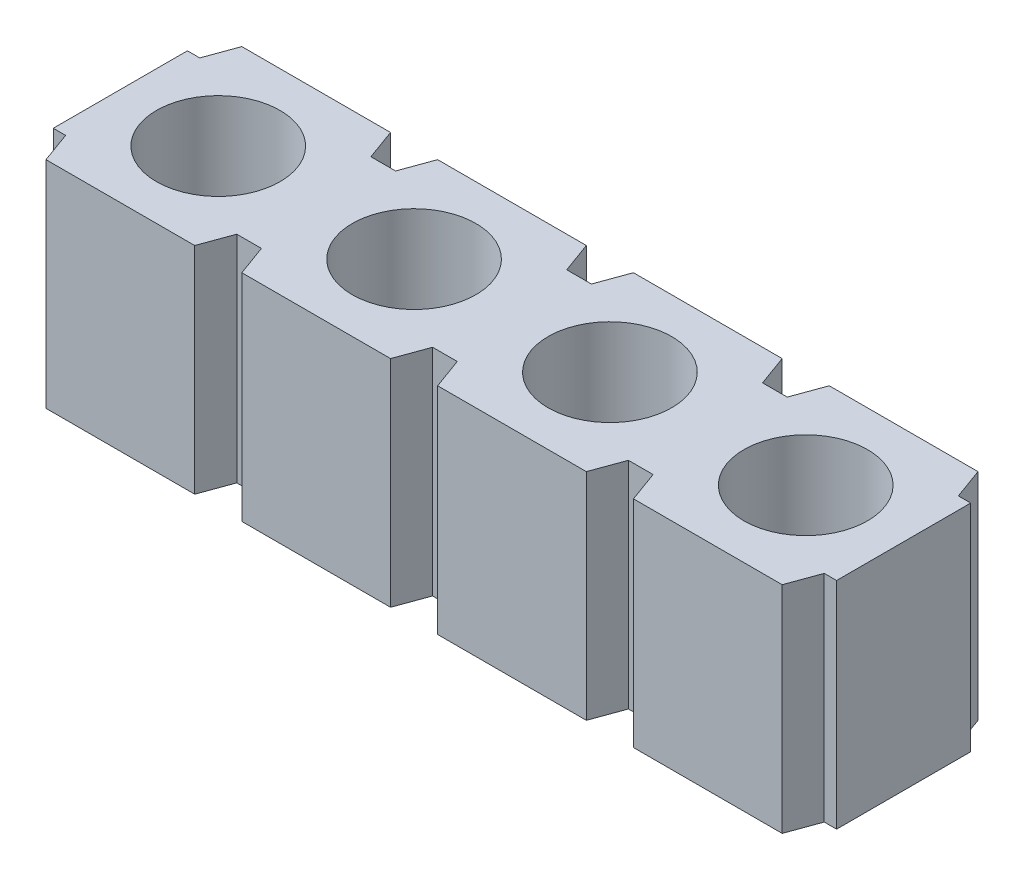
from build123d import *

# Parameters (mm, degrees)
EXTRUDE1_DEPTH  = 2.794
HOLE1_D         = 1.60274
EXTRUDE2_DEPTH  = 2.794
LPATTERN1_COUNT = 5
LPATTERN1_PITCH = 2.54
LPATTERN2_COUNT = 63
LPATTERN2_PITCH = 2.54


with BuildPart() as part:
    # Sketch1 → Extrude1 (new body)
    with BuildSketch(Plane(origin=(0, 0, 0), x_dir=(1, 0, 0), z_dir=(0, 1, 0))):
        Polygon((9.854373708, 0.40005), (9.694353708, 0.40005), (9.548747416, 0), (0, 0), (-0.145606292, 0.40005), (-0.305626292, 0.40005), (-0.305626292, 2.13995), (-0.145606292, 2.13995), (0, 2.54), (9.548747416, 2.54), (9.694353708, 2.13995), (9.854373708, 2.13995), align=None)
    extrude(amount=-EXTRUDE1_DEPTH)

    # Hole1 (through all)
    with Locations(Plane(origin=(0.964373708, 0, -1.27), x_dir=(0, 0, 1), z_dir=(0, 1, 0))):
        with Locations((0, 0)):
            hole1 = Hole(HOLE1_D / 2)

    # Sketch4 → Extrude2 (cut)
    with BuildSketch(Plane(origin=(0, 0, 0), x_dir=(1, 0, 0), z_dir=(0, 1, 0))):
        Polygon((1.928772816, 0), (2.5399746, 0), (2.394368308, 0.40005), (2.074379108, 0.40005), align=None)
        Polygon((2.074379108, 2.13995), (2.394368308, 2.13995), (2.5399746, 2.54), (1.928772816, 2.54), align=None)
    extrude2 = extrude(amount=-EXTRUDE2_DEPTH, mode=Mode.SUBTRACT)

    # LPattern1: Hole1 ×5
    with Locations(*[(i * LPATTERN1_PITCH, 0, 0) for i in range(1, LPATTERN1_COUNT)]):
        add(hole1, mode=Mode.SUBTRACT)

    # LPattern2: Extrude2 ×63
    with Locations(*[(i * LPATTERN2_PITCH, 0, 0) for i in range(1, LPATTERN2_COUNT)]):
        add(extrude2, mode=Mode.SUBTRACT)


solid = part.part
